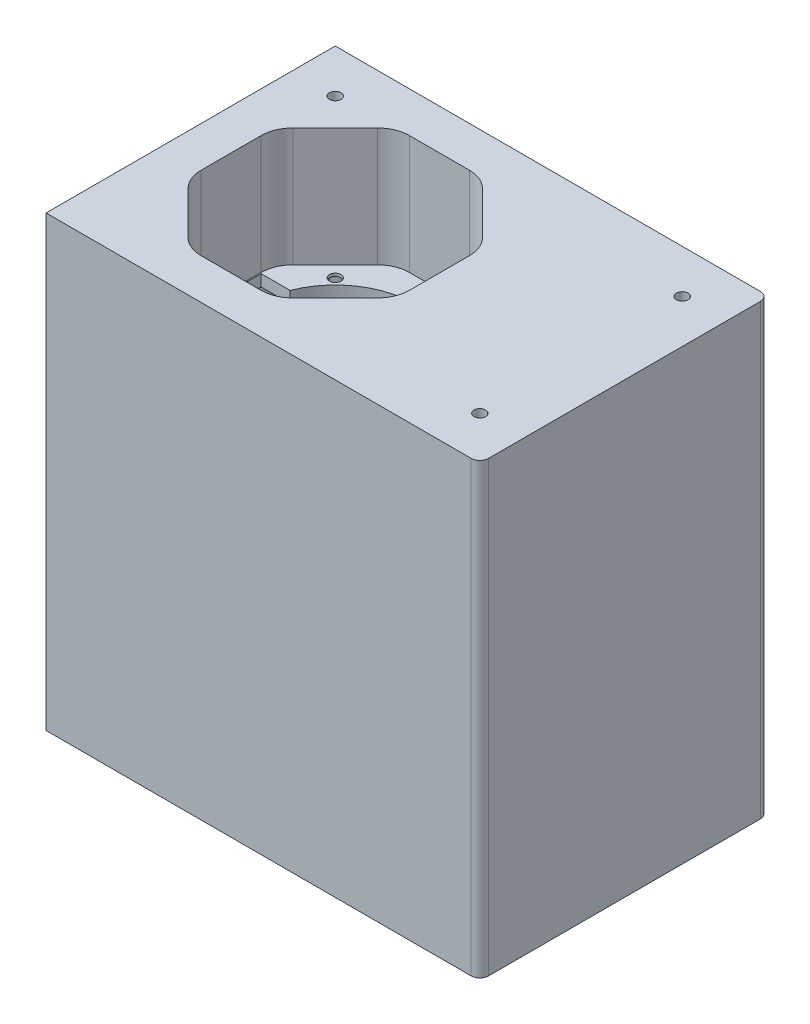
from build123d import *

# Parameters (mm, degrees)
SKETCH1_W           = 150
SKETCH1_H           = 100
BOSS_EXTRUDE1_DEPTH = 45
CUT_EXTRUDE1_DEPTH  = 41
CUT_EXTRUDE2_DEPTH  = 101.747208398
CUT_EXTRUDE3_DEPTH  = 3
SKETCH5_R           = 2
CUT_EXTRUDE4_DEPTH  = 100.025249305
SKETCH6_W           = 150
SKETCH6_H           = 100
SKETCH6_W_2         = 130
SKETCH6_H_2         = 80
BOSS_EXTRUDE2_DEPTH = 110
SKETCH7_R           = 2
CUT_EXTRUDE5_DEPTH  = 15
SKETCH11_W          = 60
SKETCH11_H          = 100
BOSS_EXTRUDE5_DEPTH = 20
SKETCH12_R          = 2
CUT_EXTRUDE6_DEPTH  = 15
SKETCH13_R          = 2
CUT_EXTRUDE7_DEPTH  = 15
SKETCH14_R          = 2
CUT_EXTRUDE8_DEPTH  = 15
SKETCH15_W          = 50
SKETCH15_H          = 80
BOSS_EXTRUDE6_DEPTH = 110
FILLET1_R           = 3


with BuildPart() as part:
    # Sketch1 → Boss-Extrude1 (new body)
    with BuildSketch(Plane(origin=(0, 0, 0), x_dir=(1, 0, 0), z_dir=(0, 1, 0))):
        Rectangle(SKETCH1_W, SKETCH1_H)
    extrude(amount=BOSS_EXTRUDE1_DEPTH)

    # Sketch2 → Cut-Extrude1 (cut)
    with BuildSketch(Plane(origin=(0, 45, 0), x_dir=(1, 0, 0), z_dir=(0, 1, 0))):
        with BuildLine():
            Line((-6.866486348, -32.778174593), (7.778174593, -18.133513652))
            ThreePointArc((7.778174593, -18.133513652), (10.162674858, -14.564856815), (11, -10.355339059))
            Line((11, -10.355339059), (11, 10.355339059))
            ThreePointArc((11, 10.355339059), (10.162674858, 14.564856815), (7.778174593, 18.133513652))
            Line((7.778174593, 18.133513652), (-6.866486348, 32.778174593))
            ThreePointArc((-6.866486348, 32.778174593), (-10.435143185, 35.162674858), (-14.644660941, 36))
            Line((-14.644660941, 36), (-35.355339059, 36))
            ThreePointArc((-35.355339059, 36), (-39.564856815, 35.162674858), (-43.133513652, 32.778174593))
            Line((-43.133513652, 32.778174593), (-57.778174593, 18.133513652))
            ThreePointArc((-57.778174593, 18.133513652), (-60.162674858, 14.564856815), (-61, 10.355339059))
            Line((-61, 10.355339059), (-61, -10.355339059))
            ThreePointArc((-61, -10.355339059), (-60.162674858, -14.564856815), (-57.778174593, -18.133513652))
            Line((-57.778174593, -18.133513652), (-43.133513652, -32.778174593))
            ThreePointArc((-43.133513652, -32.778174593), (-39.564856815, -35.162674858), (-35.355339059, -36))
            Line((-35.355339059, -36), (-14.644660941, -36))
            ThreePointArc((-14.644660941, -36), (-10.435143185, -35.162674858), (-6.866486348, -32.778174593))
        make_face()
    extrude(amount=-CUT_EXTRUDE1_DEPTH, mode=Mode.SUBTRACT)

    # Sketch3 → Cut-Extrude2 (cut, through all)
    with BuildSketch(Plane(origin=(0, 45, 0), x_dir=(1, 0, 0), z_dir=(0, 1, 0))):
        with BuildLine():
            Line((-50.617376915, 10), (-60.617376915, 10))
            Line((-60.617376915, 10), (-60.617376915, -10))
            Line((-60.617376915, -10), (-50.617376915, -10))
            ThreePointArc((-50.617376915, -10), (-35.122065553, -25.569391642), (-13.168566779, -24.824729363))
            ThreePointArc((-13.168566779, -24.824729363), (2.5, 0), (-13.168566779, 24.824729363))
            ThreePointArc((-13.168566779, 24.824729363), (-35.122065553, 25.569391642), (-50.617376915, 10))
        make_face()
    extrude(amount=-CUT_EXTRUDE2_DEPTH, mode=Mode.SUBTRACT)

    # Sketch4 → Cut-Extrude3 (cut)
    with BuildSketch(Plane.XZ):
        Polygon((-0.366016727, 22.388617676), (-2.611382324, 24.633983273), (-5.678608771, 23.812122424), (-6.500469621, 20.744895977), (-4.255104023, 18.499530379), (-1.187877576, 19.321391229), align=None)
        Polygon((-47.388617676, 24.633983273), (-49.633983273, 22.388617676), (-48.812122424, 19.321391229), (-45.744895977, 18.499530379), (-43.499530379, 20.744895977), (-44.321391229, 23.812122424), align=None)
        Polygon((-2.611382324, -24.633983273), (-0.366016727, -22.388617676), (-1.187877576, -19.321391229), (-4.255104023, -18.499530379), (-6.500469621, -20.744895977), (-5.678608771, -23.812122424), align=None)
        Polygon((-49.633983273, -22.388617676), (-47.388617676, -24.633983273), (-44.321391229, -23.812122424), (-43.499530379, -20.744895977), (-45.744895977, -18.499530379), (-48.812122424, -19.321391229), align=None)
    extrude(amount=-CUT_EXTRUDE3_DEPTH, mode=Mode.SUBTRACT)

    # Sketch5 → Cut-Extrude4 (cut, through all)
    with BuildSketch(Plane(origin=(0, 4, 0), x_dir=(1, 0, 0), z_dir=(0, 1, 0))):
        with Locations(Location((-46.566756826, 21.566756826, 0), (0, 0, 270))):
            Circle(SKETCH5_R)
        with Locations(Location((-3.433243174, 21.566756826, 0), (0, 0, 270))):
            Circle(SKETCH5_R)
        with Locations(Location((-3.433243174, -21.566756826, 0), (0, 0, 270))):
            Circle(SKETCH5_R)
        with Locations(Location((-46.566756826, -21.566756826, 0), (0, 0, 270))):
            Circle(SKETCH5_R)
    extrude(amount=-CUT_EXTRUDE4_DEPTH, mode=Mode.SUBTRACT)

    # Sketch6 → Boss-Extrude2 (add)
    with BuildSketch(Plane.XZ):
        Rectangle(SKETCH6_W, SKETCH6_H)
        Rectangle(SKETCH6_W_2, SKETCH6_H_2, mode=Mode.SUBTRACT)
    extrude(amount=BOSS_EXTRUDE2_DEPTH)

    # Sketch7 → Cut-Extrude5 (cut)
    with BuildSketch(Plane.XZ.offset(110)):
        with Locations(Location((70, 45, 0), (0, 0, 90))):
            Circle(SKETCH7_R)
        with Locations(Location((70, -45, 0), (0, 0, 270))):
            Circle(SKETCH7_R)
        with Locations(Location((-70, -30, 0), (0, 0, 90))):
            Circle(SKETCH7_R)
        with Locations(Location((-70, 12, 0), (0, 0, 270))):
            Circle(SKETCH7_R)
    extrude(amount=-CUT_EXTRUDE5_DEPTH, mode=Mode.SUBTRACT)

    # Sketch11 → Boss-Extrude5 (add)
    with BuildSketch(Plane(origin=(-75, 0, 0), x_dir=(0, 0, -1), z_dir=(1, 0, 0))):
        with Locations((0, -32.5)):
            Rectangle(SKETCH11_W, SKETCH11_H)
    extrude(amount=-BOSS_EXTRUDE5_DEPTH)

    # Sketch12 → Cut-Extrude6 (cut)
    with BuildSketch(Plane(origin=(0, 0, -30), x_dir=(-1, 0, 0), z_dir=(0, 0, -1))):
        with Locations((85, 0)):
            Circle(SKETCH12_R)
        with Locations(Location((85, -65, 0), (0, 0, 180))):
            Circle(SKETCH12_R)
    cut_extrude6 = extrude(amount=-CUT_EXTRUDE6_DEPTH, mode=Mode.SUBTRACT)

    # Mirror1: Cut-Extrude6 across plane
    add(cut_extrude6.mirror(Plane.XY), mode=Mode.SUBTRACT)

    # Sketch13 → Cut-Extrude7 (cut)
    with BuildSketch(Plane.XZ.offset(82.5)):
        with Locations(Location((-85, 15, 0), (0, 0, 270))):
            Circle(SKETCH13_R)
        with Locations(Location((-85, -15, 0), (0, 0, 90))):
            Circle(SKETCH13_R)
    extrude(amount=-CUT_EXTRUDE7_DEPTH, mode=Mode.SUBTRACT)

    # Sketch14 → Cut-Extrude8 (cut)
    with BuildSketch(Plane(origin=(0, 45, 0), x_dir=(1, 0, 0), z_dir=(0, 1, 0))):
        with Locations(Location((60, 35, 0), (0, 0, 270))):
            Circle(SKETCH14_R)
        with Locations(Location((60, -35, 0), (0, 0, 90))):
            Circle(SKETCH14_R)
        with Locations(Location((-60, 35, 0), (0, 0, 90))):
            Circle(SKETCH14_R)
    extrude(amount=-CUT_EXTRUDE8_DEPTH, mode=Mode.SUBTRACT)

    # Sketch15 → Boss-Extrude6 (add)
    with BuildSketch(Plane.XZ):
        with Locations((40, 0)):
            Rectangle(SKETCH15_W, SKETCH15_H)
    extrude(amount=BOSS_EXTRUDE6_DEPTH)

    # Fillet1
    fillet1_edges = [part.edges().sort_by_distance(p)[0] for p in [
        (-95, -32.5, -30),
        (-85, 17.5, -30),
        (-95, -82.5, 0),
        (-85, -82.5, -30),
        (-95, -32.5, 30),
        (-85, -82.5, 30),
        (-95, 17.5, 0),
        (-85, 17.5, 30),
        (75, -32.5, 50),
        (75, -32.5, -50),
    ]]
    fillet(fillet1_edges, radius=FILLET1_R)


solid = part.part
